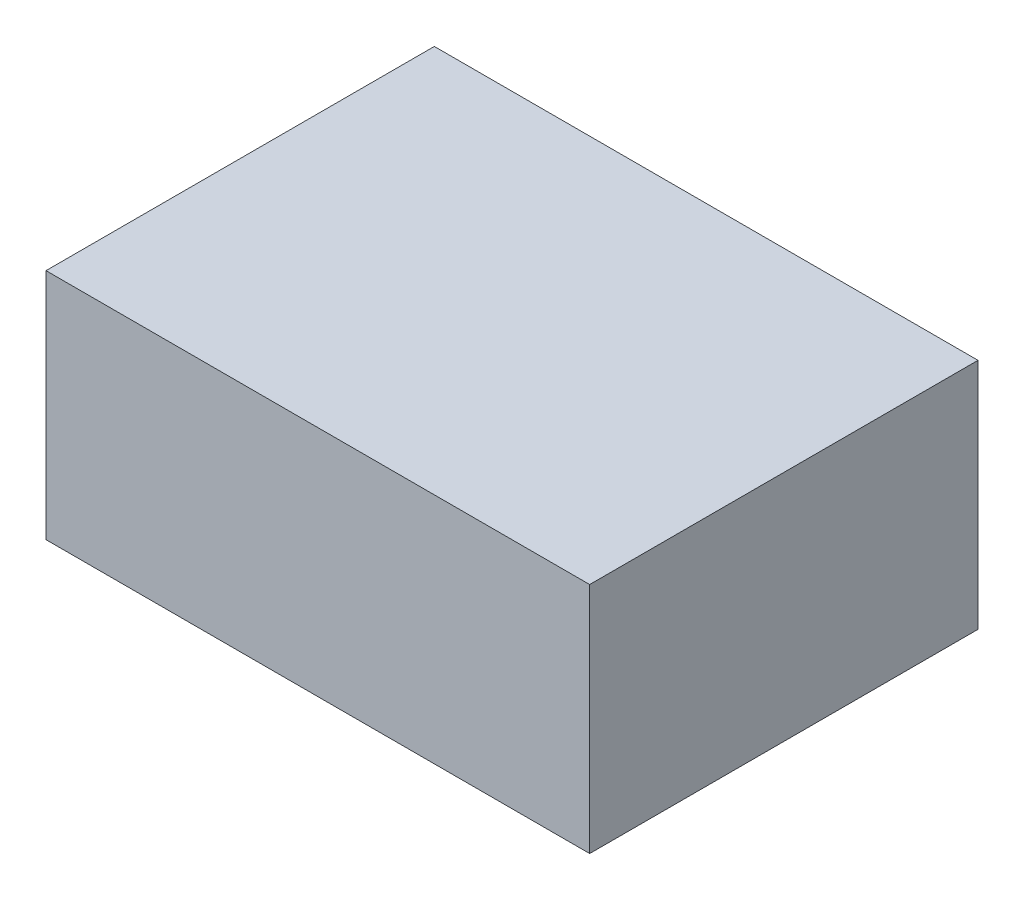
from build123d import *

# Parameters (mm, degrees)
SKETCH1_W           = 140
SKETCH1_H           = 100
BOSS_EXTRUDE1_DEPTH = 60


with BuildPart() as part:
    # Sketch1 → Boss-Extrude1 (new body)
    with BuildSketch(Plane(origin=(0, 0, 0), x_dir=(1, 0, 0), z_dir=(0, 1, 0))):
        with Locations((70, 50)):
            Rectangle(SKETCH1_W, SKETCH1_H)
    extrude(amount=BOSS_EXTRUDE1_DEPTH)


solid = part.part
